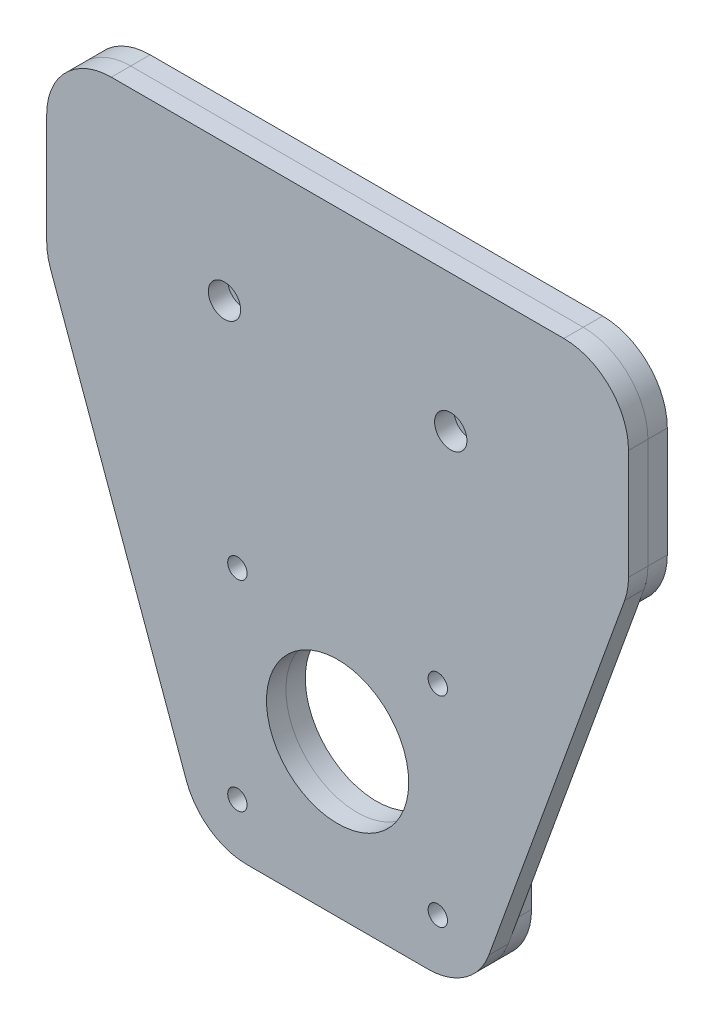
from build123d import *

# Parameters (mm, degrees)
CROQUIS1_R              = 1.5
CROQUIS1_R_2            = 2.5
CROQUIS1_R_3            = 11
SALIENTE_EXTRUIR1_DEPTH = 3
CROQUIS2_R              = 2.5
CROQUIS2_R_2            = 1.5
CROQUIS2_R_3            = 11
SALIENTE_EXTRUIR2_DEPTH = 3


with BuildPart() as part:
    # Croquis1 → Saliente-Extruir1 (new body)
    with BuildSketch(Plane.XY):
        with BuildLine():
            Line((0, 10), (0, 58))
            Line((0, 58), (-11, 58))
            ThreePointArc((-11, 58), (-18.071067812, 60.928932188), (-21, 68))
            Line((-21, 68), (-21, 85))
            ThreePointArc((-21, 85), (-18.071067812, 92.071067812), (-11, 95))
            Line((-11, 95), (59, 95))
            ThreePointArc((59, 95), (66.071067812, 92.071067812), (69, 85))
            Line((69, 85), (69, 68))
            ThreePointArc((69, 68), (66.071067812, 60.928932188), (59, 58))
            Line((59, 58), (48, 58))
            Line((48, 58), (48, 10))
            ThreePointArc((48, 10), (45.071067812, 2.928932188), (38, 0))
            Line((38, 0), (10, 0))
            ThreePointArc((10, 0), (2.928932188, 2.928932188), (0, 10))
        make_face()
        with Locations((8.5, 39)):
            Circle(CROQUIS1_R, mode=Mode.SUBTRACT)
        with Locations((39.5, 39)):
            Circle(CROQUIS1_R, mode=Mode.SUBTRACT)
        with Locations((39.5, 8)):
            Circle(CROQUIS1_R, mode=Mode.SUBTRACT)
        with Locations((8.5, 8)):
            Circle(CROQUIS1_R, mode=Mode.SUBTRACT)
        with Locations((6.5, 76.5)):
            Circle(CROQUIS1_R_2, mode=Mode.SUBTRACT)
        with Locations(Location((41.5, 76.5, 0), (0, 0, 180))):
            Circle(CROQUIS1_R_2, mode=Mode.SUBTRACT)
        with Locations((24, 23.5)):
            Circle(CROQUIS1_R_3, mode=Mode.SUBTRACT)
    extrude(amount=SALIENTE_EXTRUIR1_DEPTH)


with BuildPart() as body_2:
    # Croquis2 → Saliente-Extruir2 (new body)
    with BuildSketch(Plane.XY.offset(3)):
        with BuildLine():
            Line((-20.4026585, 64.595589164), (0.5973415, 6.595589164))
            ThreePointArc((0.5973415, 6.595589164), (4.257357244, 1.813300165), (10, 0))
            Line((10, 0), (38, 0))
            ThreePointArc((38, 0), (43.742642756, 1.813300165), (47.4026585, 6.595589164))
            Line((47.4026585, 6.595589164), (68.4026585, 64.595589164))
            ThreePointArc((68.4026585, 64.595589164), (68.849532603, 66.271790666), (69, 68))
            Line((69, 68), (69, 85))
            ThreePointArc((69, 85), (66.071067812, 92.071067812), (59, 95))
            Line((59, 95), (-11, 95))
            ThreePointArc((-11, 95), (-18.071067812, 92.071067812), (-21, 85))
            Line((-21, 85), (-21, 68))
            ThreePointArc((-21, 68), (-20.849532603, 66.271790666), (-20.4026585, 64.595589164))
        make_face()
        with Locations((41.5, 73.82)):
            Circle(CROQUIS2_R, mode=Mode.SUBTRACT)
        with Locations((8.5, 8)):
            Circle(CROQUIS2_R_2, mode=Mode.SUBTRACT)
        with Locations((8.5, 39)):
            Circle(CROQUIS2_R_2, mode=Mode.SUBTRACT)
        with Locations((39.5, 8)):
            Circle(CROQUIS2_R_2, mode=Mode.SUBTRACT)
        with Locations((24, 23.5)):
            Circle(CROQUIS2_R_3, mode=Mode.SUBTRACT)
        with Locations((39.5, 39)):
            Circle(CROQUIS2_R_2, mode=Mode.SUBTRACT)
        with Locations((6.5, 73.82)):
            Circle(CROQUIS2_R, mode=Mode.SUBTRACT)
    extrude(amount=SALIENTE_EXTRUIR2_DEPTH)


solid = Compound([part.part, body_2.part])
